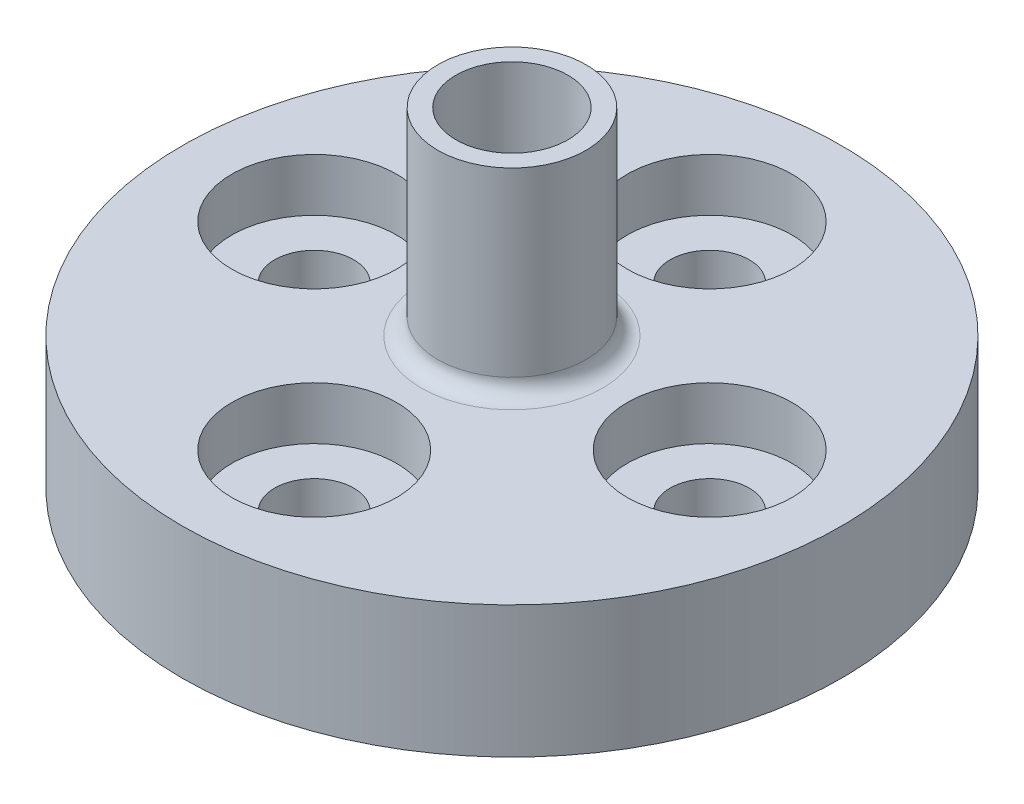
from build123d import *

# Parameters (mm, degrees)
SKETCH1_R                                           = 10
BOSS_EXTRUDE1_DEPTH                                 = 4
CBORE_FOR_M2_PAN_HEAD_SCREW1_D                      = 2.4
CBORE_FOR_M2_PAN_HEAD_SCREW1_CBORE_D                = 5
CBORE_FOR_M2_PAN_HEAD_SCREW1_CBORE_DEPTH            = 1.6
SKETCH4_R                                           = 2.25
BOSS_EXTRUDE2_DEPTH                                 = 6
CIRPATTERN1_COUNT                                   = 4
CSK_FOR_M3_COUNTERSUNK_FLAT_HEAD_SCREW1_D           = 3.4
CSK_FOR_M3_COUNTERSUNK_FLAT_HEAD_SCREW1_CSINK_D     = 6.3
CSK_FOR_M3_COUNTERSUNK_FLAT_HEAD_SCREW1_CSINK_ANGLE = 90
FILLET1_R                                           = 0.5


with BuildPart() as part:
    # Sketch1 → Boss-Extrude1 (new body)
    with BuildSketch(Plane(origin=(0, 0, 0), x_dir=(1, 0, 0), z_dir=(0, 1, 0))):
        with Locations(Location((0, 0, 0), (0, 0, 270))):
            Circle(SKETCH1_R)
    extrude(amount=BOSS_EXTRUDE1_DEPTH)

    # CBORE for M2 Pan Head Screw1 (through all)
    with Locations(Plane(origin=(0, 4, 0), x_dir=(1, 0, 0), z_dir=(0, 1, 0))):
        with Locations((6, 0)):
            cbore_for_m2_pan_head_screw1 = CounterBoreHole(CBORE_FOR_M2_PAN_HEAD_SCREW1_D / 2, CBORE_FOR_M2_PAN_HEAD_SCREW1_CBORE_D / 2, CBORE_FOR_M2_PAN_HEAD_SCREW1_CBORE_DEPTH)

    # Sketch4 → Boss-Extrude2 (add)
    with BuildSketch(Plane(origin=(0, 4, 0), x_dir=(1, 0, 0), z_dir=(0, 1, 0))):
        with Locations(Location((0, 0, 0), (0, 0, 270))):
            Circle(SKETCH4_R)
    extrude(amount=BOSS_EXTRUDE2_DEPTH)

    # CirPattern1: CBORE for M2 Pan Head Screw1 ×4 about axis
    cirpattern1_axis = Axis((0, 0, 0), (0, 1, 0))
    for i in range(1, CIRPATTERN1_COUNT):
        add(cbore_for_m2_pan_head_screw1.rotate(cirpattern1_axis, i * 360 / CIRPATTERN1_COUNT), mode=Mode.SUBTRACT)

    # CSK for M3 Countersunk Flat Head Screw1 (through all)
    with Locations(Plane.XZ):
        with Locations((0, 0)):
            CounterSinkHole(CSK_FOR_M3_COUNTERSUNK_FLAT_HEAD_SCREW1_D / 2, CSK_FOR_M3_COUNTERSUNK_FLAT_HEAD_SCREW1_CSINK_D / 2, counter_sink_angle=CSK_FOR_M3_COUNTERSUNK_FLAT_HEAD_SCREW1_CSINK_ANGLE)

    # Fillet1
    fillet1_edges = [part.edges().sort_by_distance(p)[0] for p in [
        (0, 4, -2.25),
    ]]
    fillet(fillet1_edges, radius=FILLET1_R)


solid = part.part
